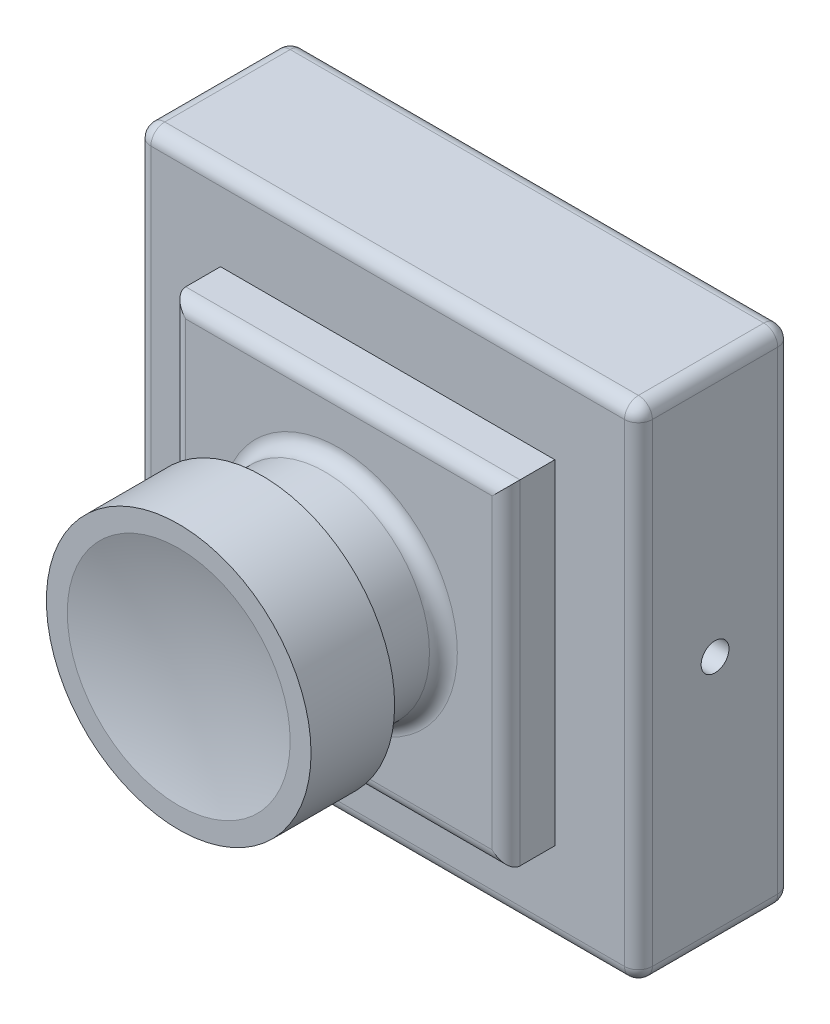
from build123d import *

# Parameters (mm, degrees)
SKETCH_1_W          = 36
SKETCH_1_H          = 36
EXTRUDE_1_DEPTH     = 11
SKETCH_2_W          = 24
SKETCH_2_H          = 24
EXTRUDE_2_DEPTH     = 3.5
SKETCH_3_R          = 7.5
EXTRUDE_3_DEPTH     = 5.5
SKETCH_4_R          = 9.5
EXTRUDE_4_DEPTH     = 6
FILLET_1_R          = 1
SKETCH_6_R          = 1
CUT_EXTRUDE_1_DEPTH = 5
SKETCH_7_R          = 1
CUT_EXTRUDE_2_DEPTH = 5


with BuildPart() as part:
    # 草图1 → 凸台-拉伸1 (new body)
    with BuildSketch(Plane.XY):
        Rectangle(SKETCH_1_W, SKETCH_1_H)
    extrude(amount=EXTRUDE_1_DEPTH)

    # 草图2 → 凸台-拉伸2 (add)
    with BuildSketch(Plane.XY.offset(11)):
        Rectangle(SKETCH_2_W, SKETCH_2_H)
    extrude(amount=EXTRUDE_2_DEPTH)

    # 草图3 → 凸台-拉伸3 (add)
    with BuildSketch(Plane.XY.offset(14.5)):
        Circle(SKETCH_3_R)
    extrude(amount=EXTRUDE_3_DEPTH)

    # 草图4 → 凸台-拉伸4 (add)
    with BuildSketch(Plane.XY.offset(20)):
        Circle(SKETCH_4_R)
    extrude(amount=EXTRUDE_4_DEPTH)

    # 草图5 → 切除-旋转1 (revolve, cut)
    with BuildSketch(Plane(origin=(0, 0, 0), x_dir=(1, 0, 0), z_dir=(0, 1, 0))):
        with BuildLine():
            Line((0, -24.91366459), (0, -26))
            Line((0, -26), (8, -26))
            ThreePointArc((8, -26), (4.036710437, -25.186488995), (0, -24.91366459))
        make_face()
    revolve(axis=Axis((0, 0, 24.353707744), (0, 0, 1)), mode=Mode.SUBTRACT)

    # 圆角1
    fillet_1_edges = [part.edges().sort_by_distance(p)[0] for p in [
        (-18, 0, 11),
        (0, -18, 11),
        (-12, 0, 14.5),
        (0, -12, 14.5),
        (12, 0, 14.5),
        (0, 12, 14.5),
        (-7.5, 0, 14.5),
        (18, 0, 11),
        (0, -18, 0),
        (-18, 0, 0),
        (0, 18, 0),
        (18, 0, 0),
        (18, -18, 5.5),
        (-18, -18, 5.5),
        (-18, 18, 5.5),
        (18, 18, 5.5),
        (0, 18, 11),
    ]]
    fillet(fillet_1_edges, radius=FILLET_1_R)

    # 草图6 → 切除-拉伸1 (cut)
    with BuildSketch(Plane(origin=(18, 0, 0), x_dir=(0, 0, -1), z_dir=(1, 0, 0))):
        with Locations((-5.5, 0)):
            Circle(SKETCH_6_R)
    cut_extrude_1 = extrude(amount=-CUT_EXTRUDE_1_DEPTH, mode=Mode.SUBTRACT)

    # 镜向1: 切除-拉伸1 across plane
    add(cut_extrude_1.mirror(Plane(origin=(0, 0, 0), x_dir=(0, 0, 1), z_dir=(1, 0, 0))), mode=Mode.SUBTRACT)

    # 草图7 → 切除-拉伸2 (cut)
    with BuildSketch(Plane(origin=(0, 0, 0), x_dir=(-1, 0, 0), z_dir=(0, 0, -1))):
        with Locations((-14, 14)):
            Circle(SKETCH_7_R)
        with Locations(Location((-14, -14, 0), (0, 0, 180))):
            Circle(SKETCH_7_R)
        with Locations((14, -14)):
            Circle(SKETCH_7_R)
        with Locations(Location((14, 14, 0), (0, 0, 180))):
            Circle(SKETCH_7_R)
    extrude(amount=-CUT_EXTRUDE_2_DEPTH, mode=Mode.SUBTRACT)


solid = part.part
